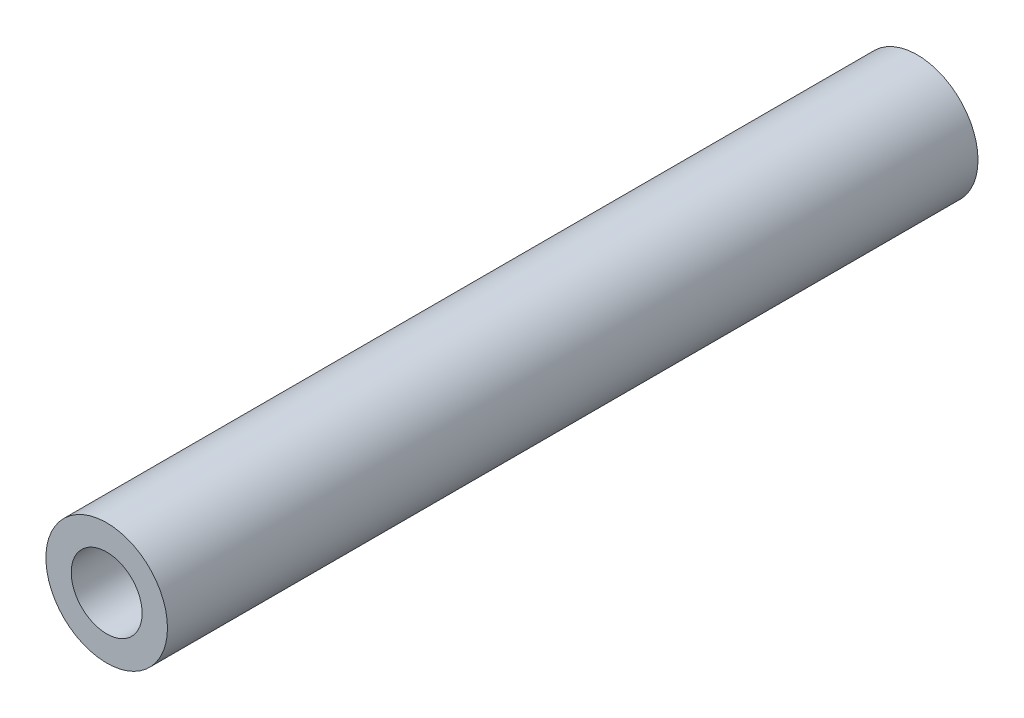
from build123d import *

# Parameters (mm, degrees)
SKETCH_1_R      = 3
SKETCH_1_R_2    = 1.75
EXTRUDE_1_DEPTH = 40


with BuildPart() as part:
    # 草图1 → 凸台-拉伸1 (new body)
    with BuildSketch(Plane.XY):
        Circle(SKETCH_1_R)
        Circle(SKETCH_1_R_2, mode=Mode.SUBTRACT)
    extrude(amount=EXTRUDE_1_DEPTH)


solid = part.part
